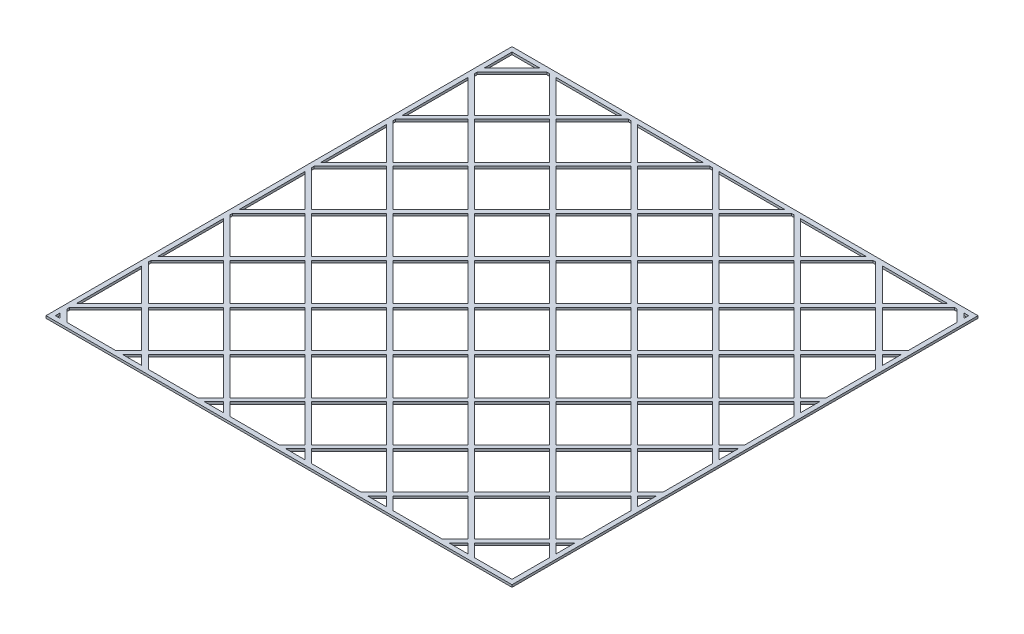
from build123d import *

# Parameters (mm, degrees)
SKETCH1_W            = 1000
SKETCH1_H            = 1000
BOSS_EXTRUDE1_DEPTH  = 2.5
CUT_EXTRUDE1_DEPTH   = 5
LPATTERN1_COUNT      = 6
LPATTERN1_PITCH      = 175
LPATTERN1_COUNT_DIR2 = 6
LPATTERN1_PITCH_DIR2 = 175
SKETCH3_W            = 1000
SKETCH3_H            = 1000
SKETCH3_W_2          = 980
SKETCH3_H_2          = 980
BOSS_EXTRUDE2_DEPTH  = 2.5


with BuildPart() as part:
    # Sketch1 → Boss-Extrude1 (new, symmetric)
    with BuildSketch(Plane(origin=(0, 0, 0), x_dir=(1, 0, 0), z_dir=(0, 1, 0))):
        Rectangle(SKETCH1_W, SKETCH1_H)
    extrude(amount=BOSS_EXTRUDE1_DEPTH, both=True)

    # Sketch2 → Cut-Extrude1 (cut)
    with BuildSketch(Plane(origin=(0, 2.5, 0), x_dir=(1, 0, 0), z_dir=(0, 1, 0))):
        Polygon((-419.571067812, 500), (-500, 500), (-500, 419.571067812), align=None)
        Polygon((-325, 500), (-405.428932188, 500), (-325, 419.571067812), align=None)
        Polygon((-492.928932188, 412.5), (-412.5, 332.071067812), (-332.071067812, 412.5), (-412.5, 492.928932188), align=None)
        Polygon((-325, 325), (-325, 405.428932188), (-405.428932188, 325), align=None)
        Polygon((-419.571067812, 325), (-500, 405.428932188), (-500, 325), align=None)
    cut_extrude1 = extrude(amount=-CUT_EXTRUDE1_DEPTH, mode=Mode.SUBTRACT)

    # LPattern1: Cut-Extrude1 6 × 6
    with Locations(*[(i * LPATTERN1_PITCH, 0, j * LPATTERN1_PITCH_DIR2) for i in range(LPATTERN1_COUNT) for j in range(LPATTERN1_COUNT_DIR2) if (i, j) != (0, 0)]):
        add(cut_extrude1, mode=Mode.SUBTRACT)

    # Sketch3 → Boss-Extrude2 (add, symmetric)
    with BuildSketch(Plane(origin=(0, 0, 0), x_dir=(1, 0, 0), z_dir=(0, 1, 0))):
        Rectangle(SKETCH3_W, SKETCH3_H)
        Rectangle(SKETCH3_W_2, SKETCH3_H_2, mode=Mode.SUBTRACT)
    extrude(amount=BOSS_EXTRUDE2_DEPTH, both=True)


solid = part.part
